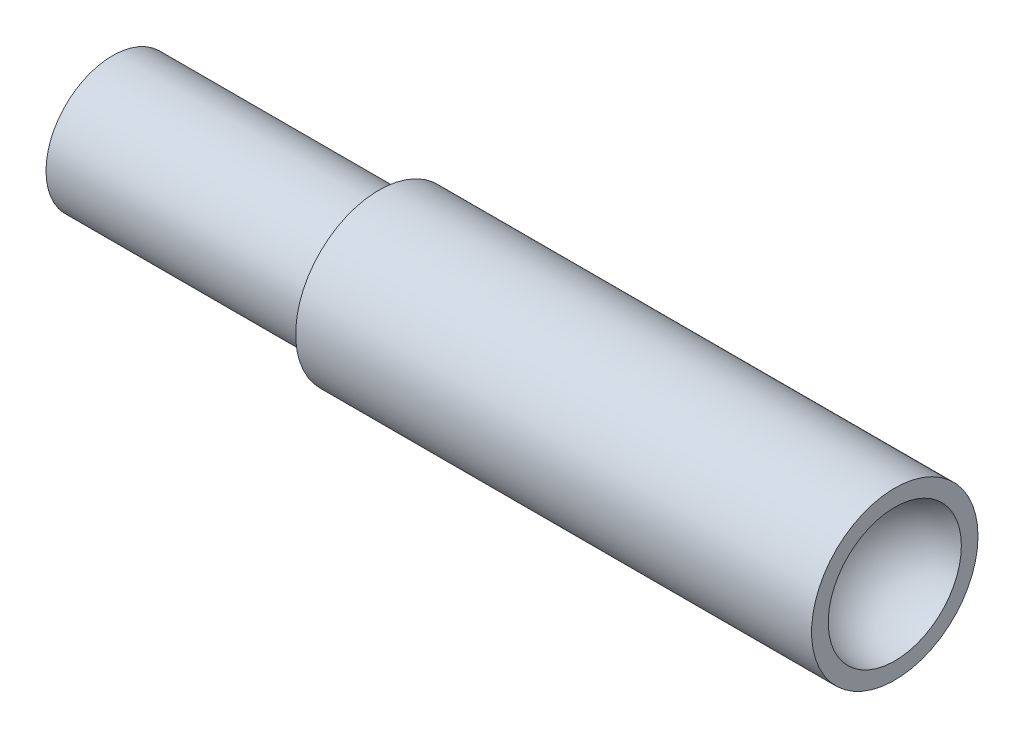
from build123d import *

# Parameters (mm, degrees)
SKETCH1_R           = 25
BOSS_EXTRUDE1_DEPTH = 155
SKETCH3_R           = 20
CUT_EXTRUDE1_DEPTH  = 100
SKETCH3_2_R         = 20
BOSS_EXTRUDE2_DEPTH = 80


with BuildPart() as part:
    # Sketch1 → Boss-Extrude1 (new body)
    with BuildSketch(Plane(origin=(0, 0, 0), x_dir=(0, 0, -1), z_dir=(1, 0, 0))):
        Circle(SKETCH1_R)
    extrude(amount=BOSS_EXTRUDE1_DEPTH)

    # Sketch2 → Cut-Revolve3 (revolve, cut)
    with BuildSketch(Plane(origin=(155, 0, 0), x_dir=(0, 0, -1), z_dir=(1, 0, 0))):
        with BuildLine():
            Line((-20, 0), (20, 0))
            ThreePointArc((20, 0), (0, 20), (-20, 0))
        make_face()
    revolve(axis=Axis((155, 0, 20), (0, 0, -1)), mode=Mode.SUBTRACT)

    # Sketch3 → Cut-Extrude1 (cut)
    with BuildSketch(Plane.ZY):
        Circle(SKETCH3_R)
    extrude(amount=-CUT_EXTRUDE1_DEPTH, mode=Mode.SUBTRACT)


with BuildPart() as body_2:
    # Sketch3<2> → Boss-Extrude2 (new body)
    with BuildSketch(Plane.ZY):
        Circle(SKETCH3_2_R)
    extrude(amount=BOSS_EXTRUDE2_DEPTH)


solid = Compound([part.part, body_2.part])
